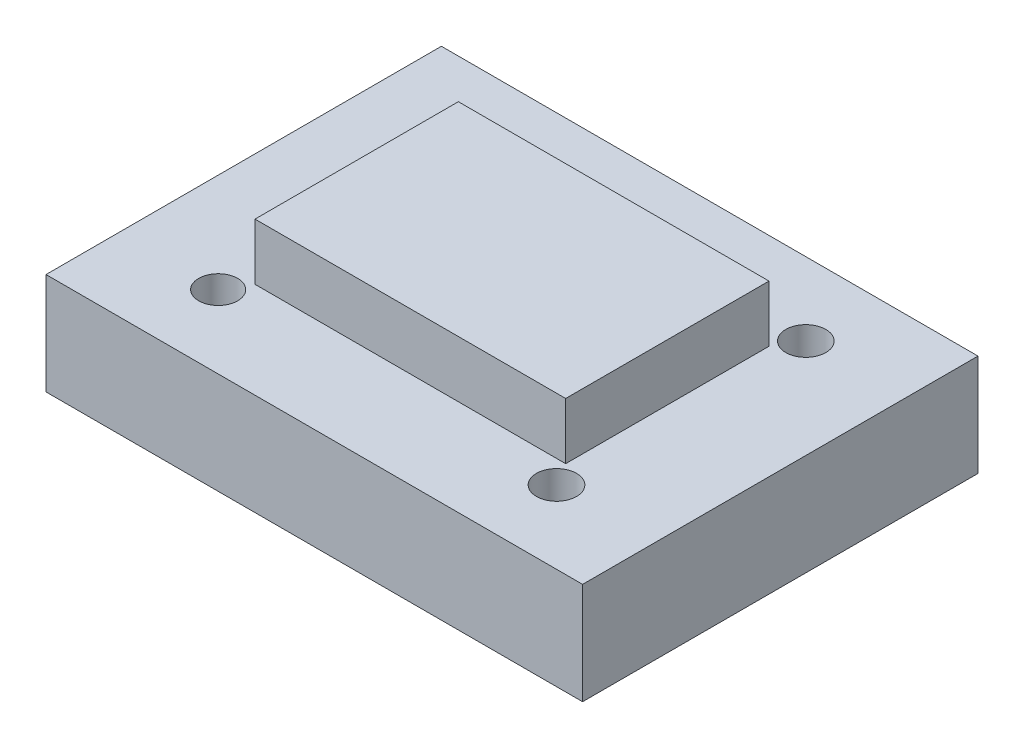
from build123d import *

# Parameters (mm, degrees)
F_01_BASE_PROFILE_W           = 95
F_01_BASE_PROFILE_H           = 70
F_01_BASE_PROFILE_R           = 3.450405227
F_01_BASE_PROFILE_R_2         = 3.5502693
F_01_BASE_PROFILE_W_2         = 25
F_01_BASE_PROFILE_H_2         = 28
F_01_BASE_EXTRUDE_DEPTH       = 18
F_02_BOSS_PROFILE_W           = 55
F_02_BOSS_PROFILE_H           = 36
F_02_REINFORCEMENT_BOSS_DEPTH = 28


with BuildPart() as part:
    # 01_Base_Profile → 01_Base_Extrude (new body)
    with BuildSketch(Plane(origin=(0, 0, 0), x_dir=(1, 0, 0), z_dir=(0, 1, 0))):
        Rectangle(F_01_BASE_PROFILE_W, F_01_BASE_PROFILE_H)
        with Locations(Location((-29.9497307, -22.068222621, 0), (0, 0, 270))):
            Circle(F_01_BASE_PROFILE_R, mode=Mode.SUBTRACT)
        with Locations(Location((29.9497307, -22.068222621, 0), (0, 0, 270))):
            Circle(F_01_BASE_PROFILE_R_2, mode=Mode.SUBTRACT)
        with Locations(Location((-29.9497307, 22.068222621, 0), (0, 0, 270))):
            Circle(F_01_BASE_PROFILE_R, mode=Mode.SUBTRACT)
        with Locations(Location((29.9497307, 22.068222621, 0), (0, 0, 270))):
            Circle(F_01_BASE_PROFILE_R_2, mode=Mode.SUBTRACT)
        Rectangle(F_01_BASE_PROFILE_W_2, F_01_BASE_PROFILE_H_2, mode=Mode.SUBTRACT)
    extrude(amount=F_01_BASE_EXTRUDE_DEPTH)

    # 02_Boss_Profile → 02_Reinforcement_Boss (add)
    with BuildSketch(Plane(origin=(0, 0, 0), x_dir=(1, 0, 0), z_dir=(0, 1, 0))):
        Rectangle(F_02_BOSS_PROFILE_W, F_02_BOSS_PROFILE_H)
    extrude(amount=F_02_REINFORCEMENT_BOSS_DEPTH)


solid = part.part
